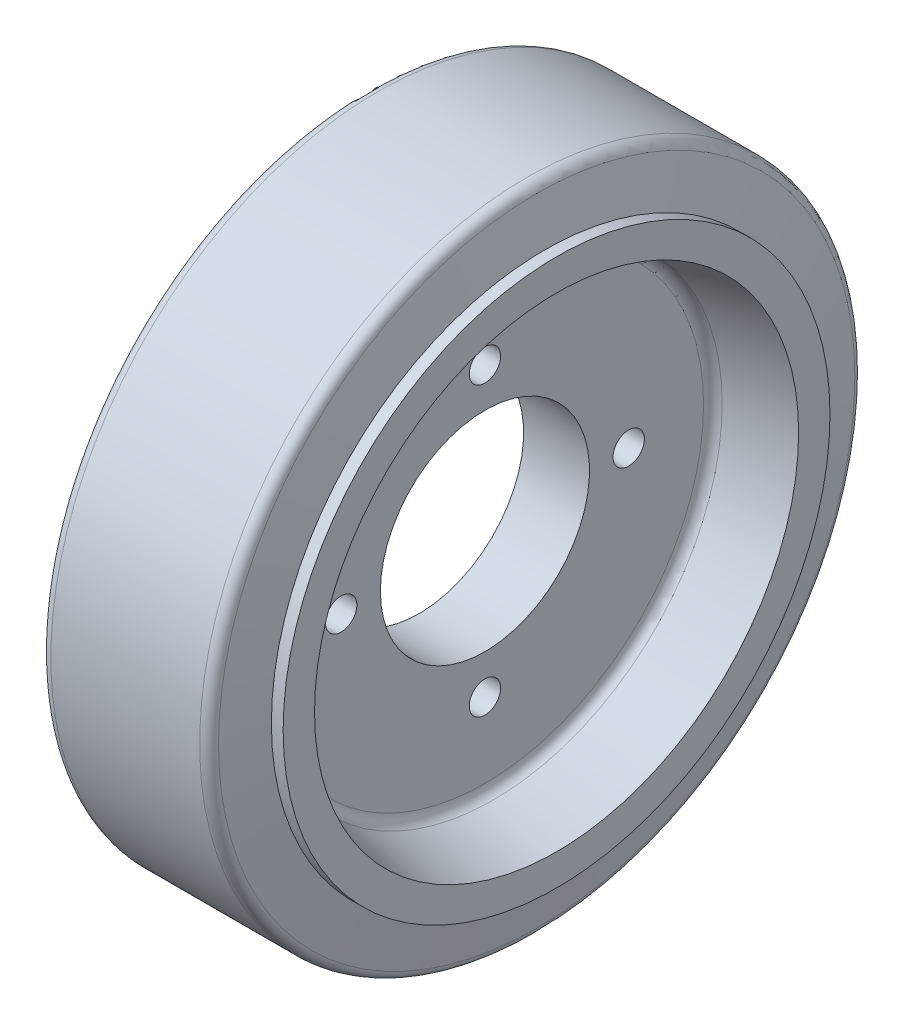
from build123d import *

# Parameters (mm, degrees)
FILLET1_R               = 2
CUT_EXTRUDE1_DEPTH      = 93.869533426
CUT_EXTRUDE1_DEPTH_BACK = 93.869533426
SKETCH2_R               = 20
SKETCH3_R               = 3
CUT_EXTRUDE2_DEPTH      = 93.218166533


with BuildPart() as part:
    # Sketch1 → Revolve1 (revolve)
    with BuildSketch(Plane.XY, mode=Mode.PRIVATE) as revolve1_sk:
        Polygon((-15.9, -62.5), (15.9, -62.5), (17.75, -52.3), (20, -52.3), (20, -46.3), (6.3, -43.45), (6.3, -17), (22.2, -15.75), (22.2, -10.05), (-22.2, -10.05), (-22.2, -15.75), (-6.3, -17), (-6.3, -43.45), (-20, -46.3), (-20, -52.3), (-17.75, -52.3), align=None)
    revolve(revolve1_sk.sketch.rotate(Axis((0, 0, 0), (1, 0, 0)), 270), axis=Axis((0, 0, 0), (1, 0, 0)))

    # Fillet1
    fillet1_edges = [part.edges().sort_by_distance(p)[0] for p in [
        (15.9, 0, -62.5),
        (-15.9, 0, -62.5),
        (-6.3, 0, -43.45),
        (-6.3, 0, -17),
        (-22.2, 0, -15.75),
        (22.2, 0, -15.75),
        (6.3, 0, -17),
        (6.3, 0, -43.45),
    ]]
    fillet(fillet1_edges, radius=FILLET1_R)

    # Sketch2 → Cut-Extrude1 (cut, two sides: drawn at the far end of the back side and taken through both)
    with BuildSketch(Plane.ZY.offset(6.3).offset(-CUT_EXTRUDE1_DEPTH_BACK)):
        Circle(SKETCH2_R)
    extrude(amount=CUT_EXTRUDE1_DEPTH + CUT_EXTRUDE1_DEPTH_BACK, mode=Mode.SUBTRACT)

    # Sketch3 → Cut-Extrude2 (cut, through all)
    with BuildSketch(Plane.ZY.offset(6.3)):
        with Locations((0, 27.5)):
            Circle(SKETCH3_R)
        with Locations((-27.5, 0)):
            Circle(SKETCH3_R)
        with Locations((0, -27.5)):
            Circle(SKETCH3_R)
        with Locations((27.5, 0)):
            Circle(SKETCH3_R)
    extrude(amount=-CUT_EXTRUDE2_DEPTH, mode=Mode.SUBTRACT)


solid = part.part
